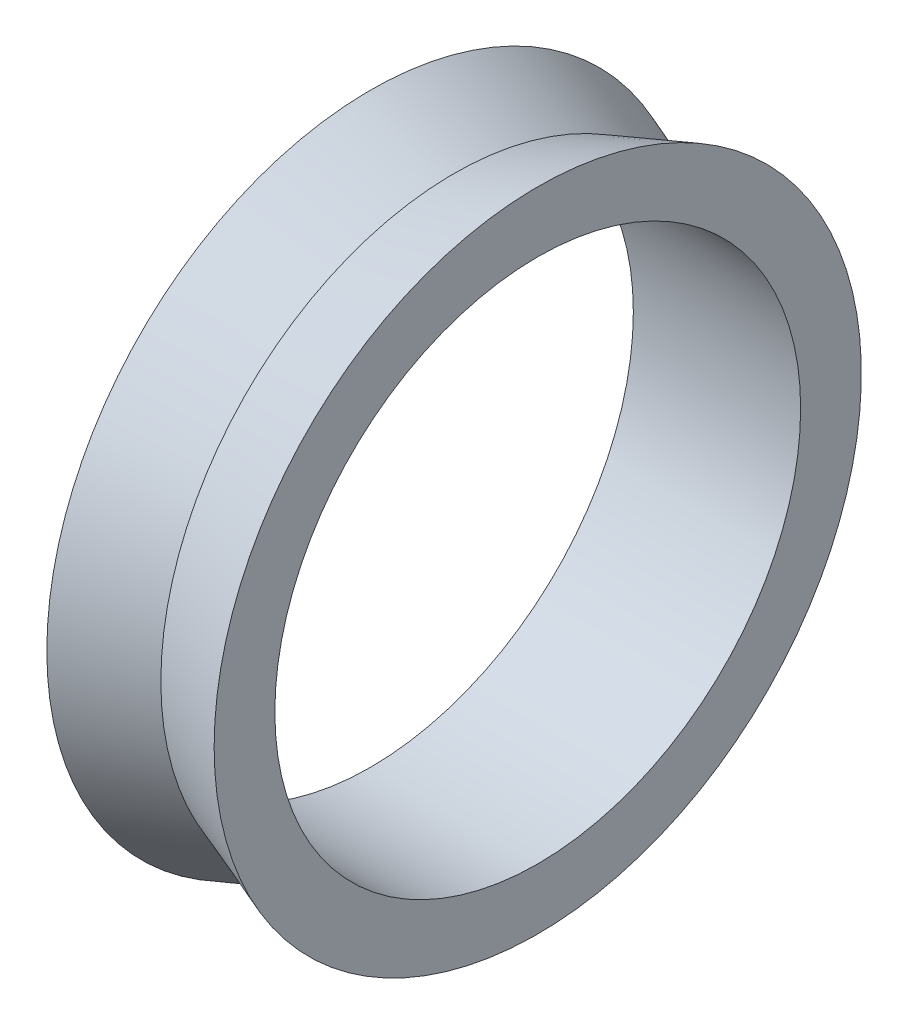
from build123d import *


with BuildPart() as part:
    # Sketch1 → Revolve1 (revolve)
    with BuildSketch(Plane.XY, mode=Mode.PRIVATE) as revolve1_sk:
        Polygon((-3.5, 11), (3.5, 11), (3.5, 13.54), (0, 12.27), (-3.5, 13.54), align=None)
    revolve(revolve1_sk.sketch.rotate(Axis((0, 0, 0), (1, 0, 0)), 90), axis=Axis((0, 0, 0), (1, 0, 0)))


solid = part.part
